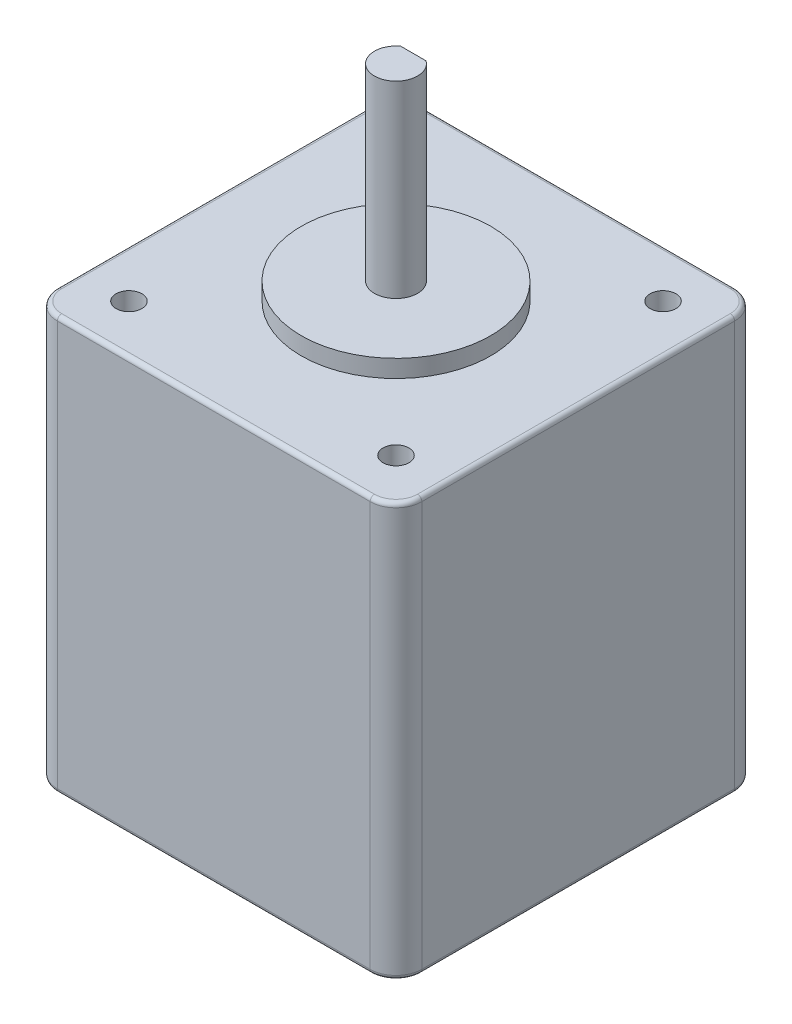
from build123d import *

# Parameters (mm, degrees)
SKETCH2_W           = 42.3
SKETCH2_H           = 42.3
SKETCH2_R           = 1.5
BOSS_EXTRUDE1_DEPTH = 48
SKETCH3_R           = 11
BOSS_EXTRUDE2_DEPTH = 2.03
SKETCH4_R           = 2.5
BOSS_EXTRUDE3_DEPTH = 21.85
CUT_EXTRUDE1_START  = -14.86
CUT_EXTRUDE1_DEPTH  = 14.86
FILLET1_R           = 3
FILLET2_R           = 0.5


with BuildPart() as part:
    # Sketch2 → Boss-Extrude1 (new body)
    with BuildSketch(Plane(origin=(0, 0, 0), x_dir=(1, 0, 0), z_dir=(0, 1, 0))):
        with Locations((21.15, 21.15)):
            Rectangle(SKETCH2_W, SKETCH2_H)
        with Locations(Location((5.655, 36.645, 0), (0, 0, 270))):
            Circle(SKETCH2_R, mode=Mode.SUBTRACT)
        with Locations(Location((36.645, 36.645, 0), (0, 0, 270))):
            Circle(SKETCH2_R, mode=Mode.SUBTRACT)
        with Locations(Location((36.645, 5.655, 0), (0, 0, 270))):
            Circle(SKETCH2_R, mode=Mode.SUBTRACT)
        with Locations(Location((5.655, 5.655, 0), (0, 0, 270))):
            Circle(SKETCH2_R, mode=Mode.SUBTRACT)
    extrude(amount=BOSS_EXTRUDE1_DEPTH)

    # Sketch3 → Boss-Extrude2 (add)
    with BuildSketch(Plane(origin=(0, 48, 0), x_dir=(1, 0, 0), z_dir=(0, 1, 0))):
        with Locations(Location((21.15, 21.15, 0), (0, 0, 270))):
            Circle(SKETCH3_R)
    extrude(amount=BOSS_EXTRUDE2_DEPTH)

    # Sketch4 → Boss-Extrude3 (add)
    with BuildSketch(Plane(origin=(0, 50.03, 0), x_dir=(1, 0, 0), z_dir=(0, 1, 0))):
        with Locations(Location((21.15, 21.15, 0), (0, 0, 270))):
            Circle(SKETCH4_R)
    extrude(amount=BOSS_EXTRUDE3_DEPTH)

    # Sketch5 → Cut-Extrude1 (cut)
    with BuildSketch(Plane(origin=(0, 71.88, 0), x_dir=(1, 0, 0), z_dir=(0, 1, 0)).offset(CUT_EXTRUDE1_START)):
        with BuildLine():
            Line((19.677043789, 23.17), (22.622956211, 23.17))
            ThreePointArc((22.622956211, 23.17), (21.15, 23.65), (19.677043789, 23.17))
        make_face()
    extrude(amount=CUT_EXTRUDE1_DEPTH, mode=Mode.SUBTRACT)

    # Fillet1
    fillet1_edges = [part.edges().sort_by_distance(p)[0] for p in [
        (0, 24, -42.3),
        (42.3, 24, -42.3),
        (42.3, 24, 0),
        (0, 24, 0),
    ]]
    fillet(fillet1_edges, radius=FILLET1_R)

    # Fillet2
    fillet2_edges = [part.edges().sort_by_distance(p)[0] for p in [
        (0, 0, -21.15),
        (0, 48, -21.15),
        (21.15, 0, -42.3),
        (42.3, 0, -21.15),
        (21.15, 0, 0),
        (0.878679656, 0, -0.878679656),
        (41.421320344, 0, -0.878679656),
        (41.421320344, 0, -41.421320344),
        (0.878679656, 0, -41.421320344),
        (21.15, 48, -42.3),
        (21.15, 48, 0),
        (42.3, 48, -21.15),
        (0.878679656, 48, -0.878679656),
        (41.421320344, 48, -0.878679656),
        (41.421320344, 48, -41.421320344),
        (0.878679656, 48, -41.421320344),
    ]]
    fillet(fillet2_edges, radius=FILLET2_R)


solid = part.part
